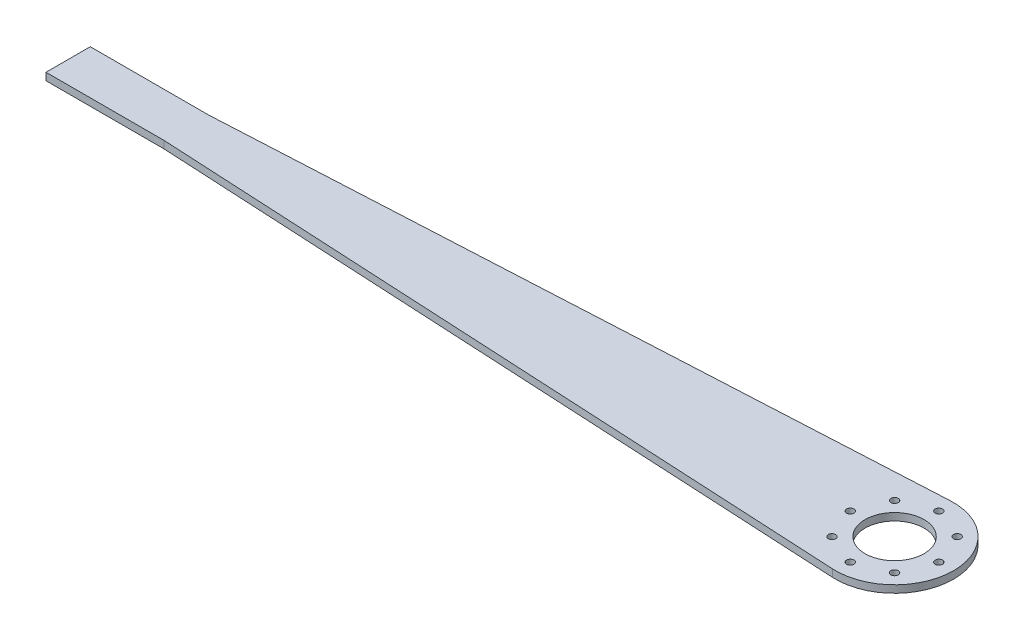
from build123d import *

# Parameters (mm, degrees)
BOSS_EXTRUDE1_DEPTH         = 6.35
SKETCH6_R                   = 25.4
CUT_EXTRUDE1_DEPTH          = 1658.310568825
F_1_4_0_25_DIAMETER_HOLE1_D = 6.35
CIRPATTERN1_COUNT           = 8


with BuildPart() as part:
    # Sketch5 → Boss-Extrude1 (new body)
    with BuildSketch(Plane(origin=(0, 0, 0), x_dir=(1, 0, 0), z_dir=(0, 1, 0))):
        with BuildLine():
            Line((-947.592639328, 61.760579697), (-1554.544647829, 30.079641))
            Line((-1554.544647829, 30.079641), (-1656.144647829, 30.079641))
            Line((-1656.144647829, 30.079641), (-1656.144647829, -8.020359))
            Line((-1656.144647829, -8.020359), (-1554.544647829, -8.020359))
            Line((-1554.544647829, -8.020359), (-947.592639328, -39.701297696))
            ThreePointArc((-947.592639328, -39.701297696), (-894.144647829, 11.029641), (-947.592639328, 61.760579697))
        make_face()
    extrude(amount=BOSS_EXTRUDE1_DEPTH)

    # Sketch6 → Cut-Extrude1 (cut, through all)
    with BuildSketch(Plane(origin=(0, 6.35, 0), x_dir=(1, 0, 0), z_dir=(0, 1, 0))):
        with Locations(Location((-944.944647829, 11.029641, 0), (0, 0, 270))):
            Circle(SKETCH6_R)
    extrude(amount=-CUT_EXTRUDE1_DEPTH, mode=Mode.SUBTRACT)

    # 1/4 (0.25) Diameter Hole1 (through all)
    with Locations(Plane(origin=(0, 6.35, 0), x_dir=(1, 0, 0), z_dir=(0, 1, 0))):
        with Locations((-944.944647829, 49.129641)):
            f_1_4_0_25_diameter_hole1 = Hole(F_1_4_0_25_DIAMETER_HOLE1_D / 2)

    # CirPattern1: 1/4 (0.25) Diameter Hole1 ×8 about axis
    cirpattern1_axis = Axis((-944.944647829, 0, -11.029641), (0, 1, 0))
    for i in range(1, CIRPATTERN1_COUNT):
        add(f_1_4_0_25_diameter_hole1.rotate(cirpattern1_axis, i * 360 / CIRPATTERN1_COUNT), mode=Mode.SUBTRACT)


solid = part.part
